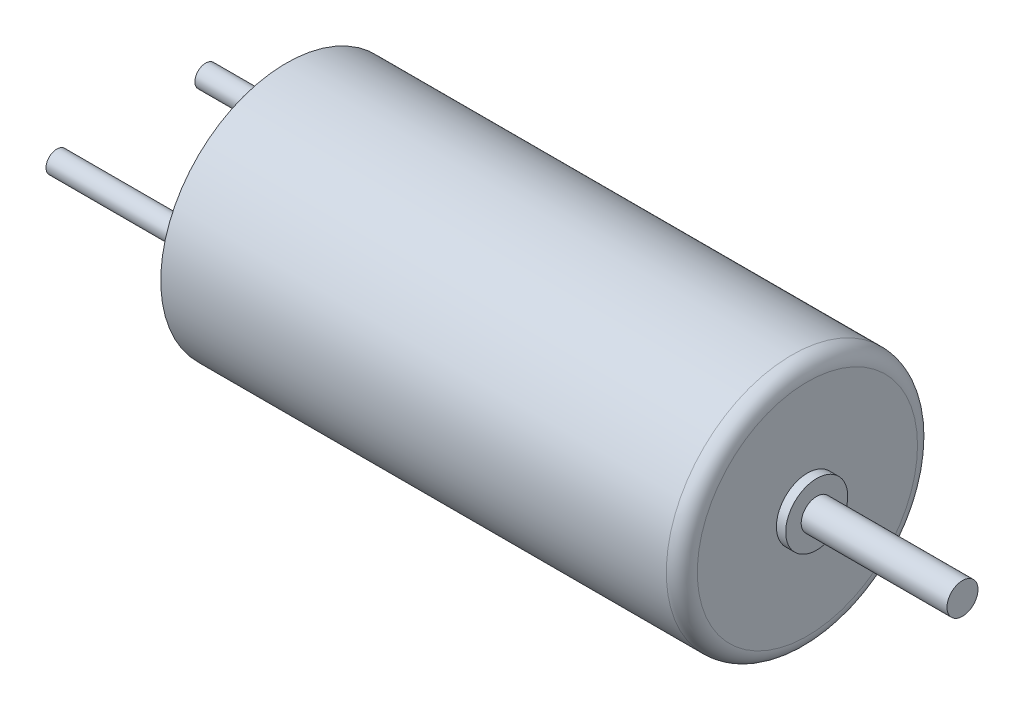
from build123d import *

# Parameters (mm, degrees)
SKETCH1_R           = 4.05
BOSS_EXTRUDE1_DEPTH = 16.8
SKETCH2_R           = 1
BOSS_EXTRUDE2_DEPTH = 0.3
SKETCH3_R           = 0.5
BOSS_EXTRUDE3_DEPTH = 4.7
SKETCH4_R           = 0.35
BOSS_EXTRUDE4_DEPTH = 5
FILLET1_R           = 0.5


with BuildPart() as part:
    # Sketch1 → Boss-Extrude1 (new body)
    with BuildSketch(Plane(origin=(0, 0, 0), x_dir=(0, 0, -1), z_dir=(1, 0, 0))):
        Circle(SKETCH1_R)
    extrude(amount=BOSS_EXTRUDE1_DEPTH)

    # Sketch2 → Boss-Extrude2 (add)
    with BuildSketch(Plane(origin=(16.8, 0, 0), x_dir=(0, 0, -1), z_dir=(1, 0, 0))):
        Circle(SKETCH2_R)
    extrude(amount=BOSS_EXTRUDE2_DEPTH)

    # Sketch3 → Boss-Extrude3 (add)
    with BuildSketch(Plane(origin=(17.1, 0, 0), x_dir=(0, 0, -1), z_dir=(1, 0, 0))):
        Circle(SKETCH3_R)
    extrude(amount=BOSS_EXTRUDE3_DEPTH)

    # Sketch4 → Boss-Extrude4 (add)
    with BuildSketch(Plane.ZY):
        with Locations(Location((2.4, 0, 0), (0, 0, 180))):
            Circle(SKETCH4_R)
        with Locations(Location((-2.4, 0, 0), (0, 0, 180))):
            Circle(SKETCH4_R)
    extrude(amount=BOSS_EXTRUDE4_DEPTH)

    # Fillet1
    fillet1_edges = [part.edges().sort_by_distance(p)[0] for p in [
        (16.8, 0, 4.05),
    ]]
    fillet(fillet1_edges, radius=FILLET1_R)


solid = part.part
